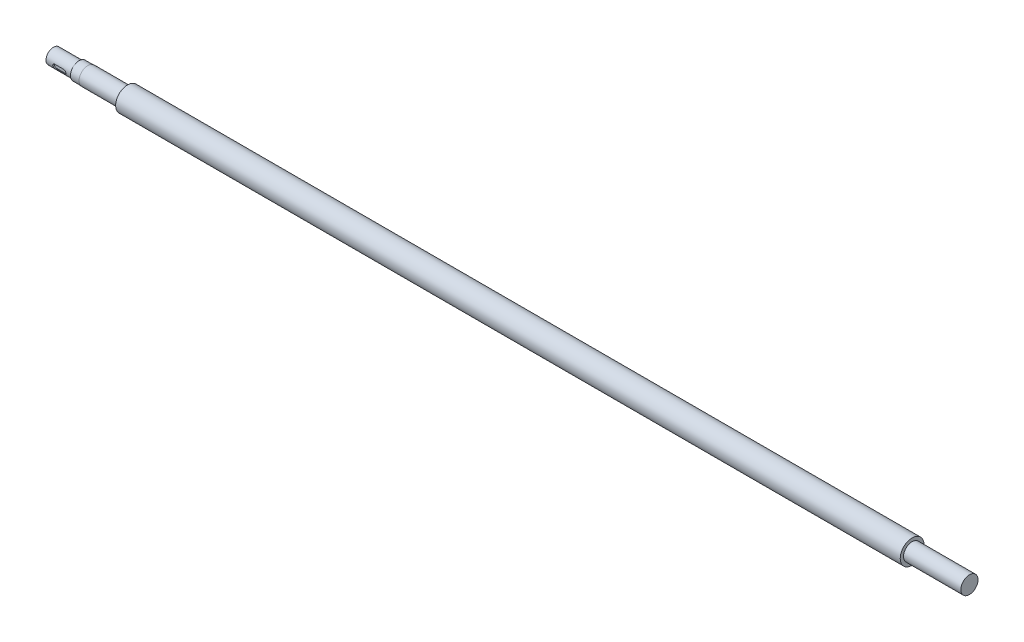
from build123d import *

# Parameters (mm, degrees)
CUT_EXTRUDE_1_DEPTH = 4


with BuildPart() as part:
    # 草图2 → 旋转5 (revolve)
    with BuildSketch(Plane.XY, mode=Mode.PRIVATE) as revolve_5_sk:
        Polygon((0, 0), (0, 17), (58, 17), (58, 19.5), (78, 19.5), (78, 20), (168, 20), (168, 27), (1948, 27), (1948, 19.5), (2078, 19.5), (2078, 0), align=None)
    revolve(revolve_5_sk.sketch.rotate(Axis((41.300309891, 0, 0), (1, 0, 0)), 90), axis=Axis((41.300309891, 0, 0), (1, 0, 0)))

    # 草图3 → 切除-拉伸1 (cut)
    with BuildSketch(Plane.XY.offset(17)):
        with BuildLine():
            Line((20, 2), (40, 2))
            ThreePointArc((40, 2), (45, -3), (40, -8))
            Line((40, -8), (20, -8))
            ThreePointArc((20, -8), (15, -3), (20, 2))
        make_face()
    extrude(amount=-CUT_EXTRUDE_1_DEPTH, mode=Mode.SUBTRACT)


solid = part.part
